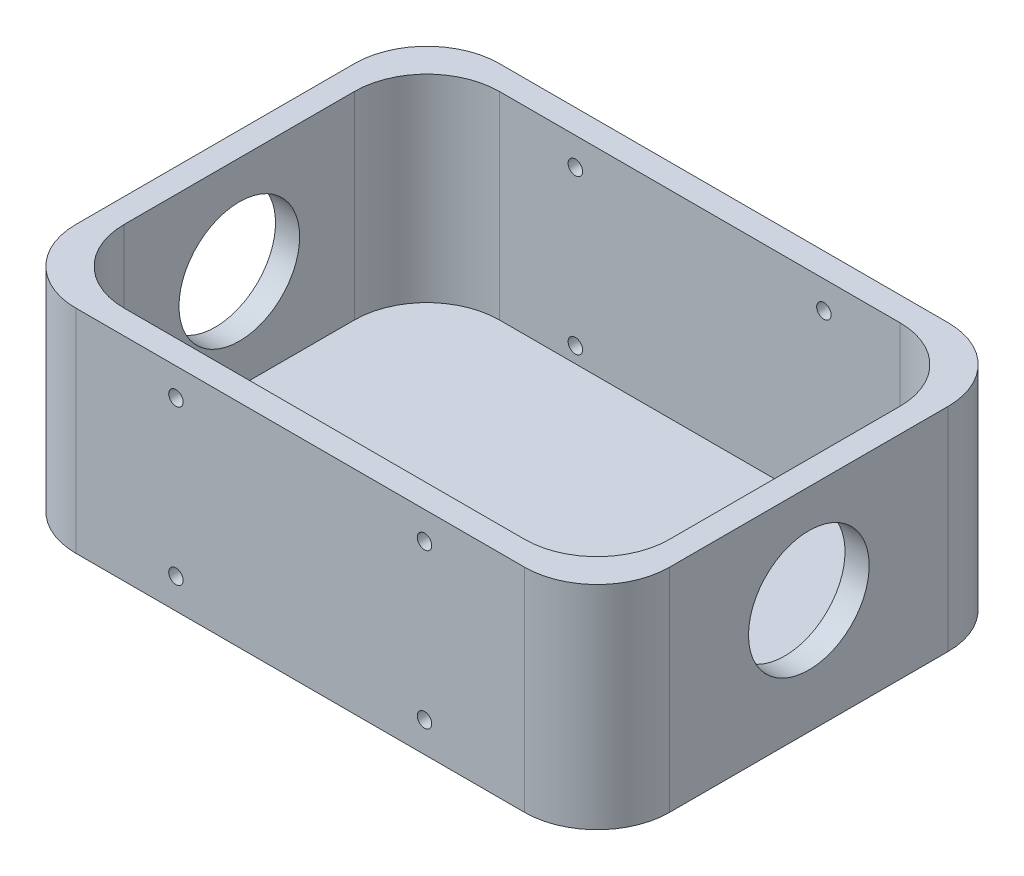
from build123d import *

# Parameters (mm, degrees)
SKETCH1_W                 = 123
SKETCH1_H                 = 87.75
SKETCH1_W_2               = 113
SKETCH1_H_2               = 77.75
BOSS_EXTRUDE1_DEPTH       = 44
SKETCH1_3_W               = 113
SKETCH1_3_H               = 77.75
BOSS_EXTRUDE2_DEPTH       = 3
FILLET1_R                 = 15
FILLET2_R                 = 15
FILLET3_R                 = 15
FILLET4_R                 = 15
FILLET5_R                 = 15
FILLET6_R                 = 15
FILLET7_R                 = 15
FILLET8_R                 = 15
SKETCH2_R                 = 1.5
CUT_EXTRUDE1_DEPTH        = 116.837439975
LPATTERN2_COPY_1_SKETCH_R = 1.5
LPATTERN2_COPY_1_DEPTH    = 116.837439975
LPATTERN2_COPY_2_SKETCH_R = 1.5
LPATTERN2_COPY_2_DEPTH    = 116.837439975
CUT_EXTRUDE2_DEPTH        = 138.804265627


with BuildPart() as part:
    # Sketch1 → Boss-Extrude1 (new body)
    with BuildSketch(Plane(origin=(0, 0, 0), x_dir=(1, 0, 0), z_dir=(0, 1, 0))):
        Rectangle(SKETCH1_W, SKETCH1_H)
        Rectangle(SKETCH1_W_2, SKETCH1_H_2, mode=Mode.SUBTRACT)
    extrude(amount=BOSS_EXTRUDE1_DEPTH)

    # Sketch1<3> → Boss-Extrude2 (add)
    with BuildSketch(Plane(origin=(0, 0, 0), x_dir=(1, 0, 0), z_dir=(0, 1, 0))):
        Rectangle(SKETCH1_3_W, SKETCH1_3_H)
    extrude(amount=BOSS_EXTRUDE2_DEPTH)

    # Fillet1
    fillet1_edges = [part.edges().sort_by_distance(p)[0] for p in [
        (-61.5, 22, 43.875),
    ]]
    fillet(fillet1_edges, radius=FILLET1_R)

    # Fillet2
    fillet2_edges = [part.edges().sort_by_distance(p)[0] for p in [
        (-61.5, 22, -43.875),
    ]]
    fillet(fillet2_edges, radius=FILLET2_R)

    # Fillet3
    fillet3_edges = [part.edges().sort_by_distance(p)[0] for p in [
        (61.5, 22, -43.875),
    ]]
    fillet(fillet3_edges, radius=FILLET3_R)

    # Fillet4
    fillet4_edges = [part.edges().sort_by_distance(p)[0] for p in [
        (61.5, 22, 43.875),
    ]]
    fillet(fillet4_edges, radius=FILLET4_R)

    # Fillet5
    fillet5_edges = [part.edges().sort_by_distance(p)[0] for p in [
        (-56.5, 23.5, -38.875),
    ]]
    fillet(fillet5_edges, radius=FILLET5_R)

    # Fillet6
    fillet6_edges = [part.edges().sort_by_distance(p)[0] for p in [
        (-56.5, 23.5, 38.875),
    ]]
    fillet(fillet6_edges, radius=FILLET6_R)

    # Fillet7
    fillet7_edges = [part.edges().sort_by_distance(p)[0] for p in [
        (56.5, 23.5, -38.875),
    ]]
    fillet(fillet7_edges, radius=FILLET7_R)

    # Fillet8
    fillet8_edges = [part.edges().sort_by_distance(p)[0] for p in [
        (56.5, 23.5, 38.875),
    ]]
    fillet(fillet8_edges, radius=FILLET8_R)

    # Sketch2 → Cut-Extrude1 (cut, through all)
    with BuildSketch(Plane(origin=(0, 0, -43.875), x_dir=(-1, 0, 0), z_dir=(0, 0, -1))):
        with Locations((-25.75, 6.25)):
            Circle(SKETCH2_R)
    cut_extrude1 = extrude(amount=-CUT_EXTRUDE1_DEPTH, mode=Mode.SUBTRACT)

    # Mirror1: Cut-Extrude1 across plane
    add(cut_extrude1.mirror(Plane(origin=(0, 0, 0), x_dir=(0, 0, 1), z_dir=(1, 0, 0))), mode=Mode.SUBTRACT)

    # LPattern2 copy 1 sketch → LPattern2 copy 1 (cut, through all)
    with BuildSketch(Plane(origin=(0, 32, -43.875), x_dir=(1, 0, 0), z_dir=(0, 0, -1))):
        with Locations((-25.75, -6.25)):
            Circle(LPATTERN2_COPY_1_SKETCH_R)
    extrude(amount=-LPATTERN2_COPY_1_DEPTH, mode=Mode.SUBTRACT)

    # LPattern2 copy 2 sketch → LPattern2 copy 2 (cut, through all)
    with BuildSketch(Plane(origin=(0, 32, -43.875), x_dir=(-1, 0, 0), z_dir=(0, 0, -1))):
        with Locations((-25.75, 6.25)):
            Circle(LPATTERN2_COPY_2_SKETCH_R)
    extrude(amount=-LPATTERN2_COPY_2_DEPTH, mode=Mode.SUBTRACT)

    # Sketch3 → Cut-Extrude2 (cut, through all)
    with BuildSketch(Plane.ZY.offset(61.5)):
        with BuildLine():
            ThreePointArc((0, 36.12), (-8.838834765, 14.781165235), (12.5, 23.62))
            ThreePointArc((12.5, 23.62), (8.838834765, 32.458834765), (0, 36.12))
        make_face()
    extrude(amount=-CUT_EXTRUDE2_DEPTH, mode=Mode.SUBTRACT)


solid = part.part
